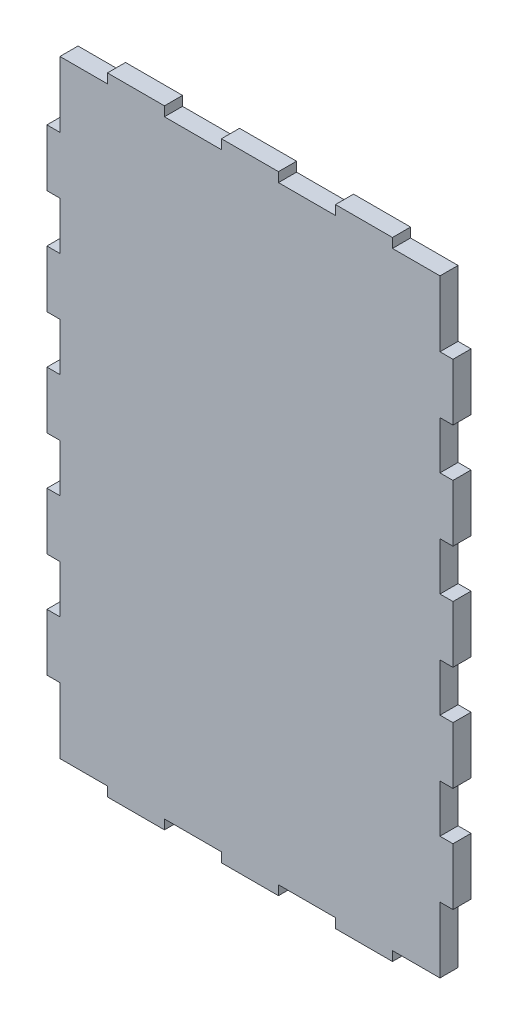
from build123d import *

# Parameters (mm, degrees)
SKETCH1_W           = 127
SKETCH1_H           = 203.2
BOSS_EXTRUDE1_DEPTH = 6.0452
SKETCH2_W           = 19.05
SKETCH2_H           = 6.35
BOSS_EXTRUDE2_DEPTH = 6.0452
SKETCH3_W           = 8.6868
SKETCH3_H           = 19.05
BOSS_EXTRUDE3_DEPTH = 6.0452


with BuildPart() as part:
    # Sketch1 → Boss-Extrude1 (new body)
    with BuildSketch(Plane.XY):
        Rectangle(SKETCH1_W, SKETCH1_H)
    extrude(amount=BOSS_EXTRUDE1_DEPTH)

    # Sketch2 → Boss-Extrude2 (add)
    with BuildSketch(Plane.XY.offset(6.0452)):
        with Locations((0, 101.6)):
            Rectangle(SKETCH2_W, SKETCH2_H)
        with Locations((-38.1, 101.6)):
            Rectangle(SKETCH2_W, SKETCH2_H)
        with Locations((38.1, 101.6)):
            Rectangle(SKETCH2_W, SKETCH2_H)
        with Locations((38.1, -101.6)):
            Rectangle(SKETCH2_W, SKETCH2_H)
        with Locations((-38.1, -101.6)):
            Rectangle(SKETCH2_W, SKETCH2_H)
        with Locations((0, -101.6)):
            Rectangle(SKETCH2_W, SKETCH2_H)
    extrude(amount=-BOSS_EXTRUDE2_DEPTH)

    # Sketch3 → Boss-Extrude3 (add)
    with BuildSketch(Plane.XY.offset(6.0452)):
        with Locations((63.5, 0)):
            Rectangle(SKETCH3_W, SKETCH3_H)
        with Locations((63.5, 35.052)):
            Rectangle(SKETCH3_W, SKETCH3_H)
        with Locations((63.5, 70.104)):
            Rectangle(SKETCH3_W, SKETCH3_H)
        with Locations((63.5, -70.104)):
            Rectangle(SKETCH3_W, SKETCH3_H)
        with Locations((63.5, -35.052)):
            Rectangle(SKETCH3_W, SKETCH3_H)
        with Locations((-63.5, -35.052)):
            Rectangle(SKETCH3_W, SKETCH3_H)
        with Locations((-63.5, -70.104)):
            Rectangle(SKETCH3_W, SKETCH3_H)
        with Locations((-63.5, 70.104)):
            Rectangle(SKETCH3_W, SKETCH3_H)
        with Locations((-63.5, 35.052)):
            Rectangle(SKETCH3_W, SKETCH3_H)
        with Locations((-63.5, 0)):
            Rectangle(SKETCH3_W, SKETCH3_H)
    extrude(amount=-BOSS_EXTRUDE3_DEPTH)


solid = part.part
